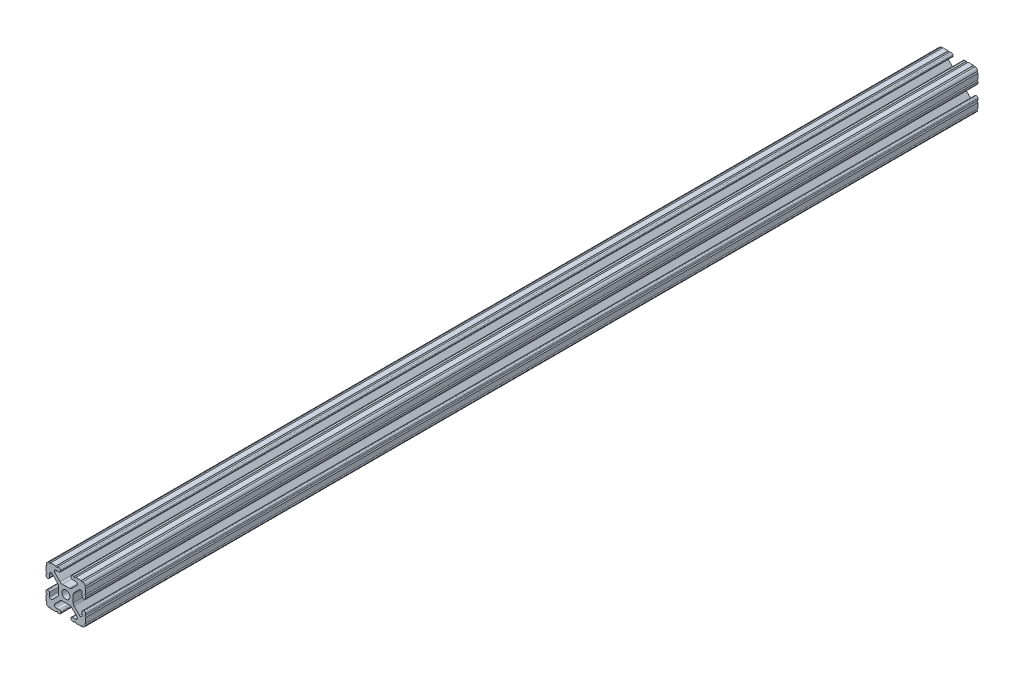
from build123d import *

# Parameters (mm, degrees)
BOSS_EXTRUDE1_DEPTH     = 1524
CUT_EXTRUDE1_DEPTH      = 1525.105829659
CUT_EXTRUDE1_DEPTH_BACK = 1525.105829659
SKETCH5_R               = 0.55245
CUT_EXTRUDE2_DEPTH      = 1525.105829659
CUT_EXTRUDE2_DEPTH_BACK = 1525.105829659
SKETCH8_W               = 50.559993734
SKETCH8_H               = 2489.2


with BuildPart() as part:
    # Sketch4 → Boss-Extrude1 (new, symmetric)
    with BuildSketch(Plane.XY):
        with BuildLine():
            Line((4.190365, -12.7), (10.11729625, -12.7))
            ThreePointArc((10.11729625, -12.7), (11.943543585, -11.943543585), (12.7, -10.11729625))
            Line((12.7, -10.11729625), (12.7, -4.190365))
            ThreePointArc((12.7, -4.190365), (12.42492494, -3.52627506), (11.760835, -3.2512))
            Line((11.760835, -3.2512), (11.429365, -3.2512))
            ThreePointArc((11.429365, -3.2512), (10.76527506, -3.52627506), (10.4902, -4.190365))
            Line((10.4902, -4.190365), (10.4902, -6.348478019))
            ThreePointArc((10.4902, -6.348478019), (9.830707141, -7.335478831), (8.666460301, -7.103895736))
            Line((8.666460301, -7.103895736), (5.299899128, -3.737334563))
            ThreePointArc((5.299899128, -3.737334563), (4.817571085, -3.015479634), (4.6482, -2.16399369))
            Line((4.6482, -2.16399369), (4.6482, 0))
            Line((4.6482, 0), (2.6035, 0))
            ThreePointArc((2.6035, 0), (1.840952505, -1.840952505), (0, -2.6035))
            Line((0, -2.6035), (0, -4.6482))
            Line((0, -4.6482), (2.16399369, -4.6482))
            ThreePointArc((2.16399369, -4.6482), (3.015479634, -4.817571085), (3.737334563, -5.299899128))
            Line((3.737334563, -5.299899128), (7.103895736, -8.666460301))
            ThreePointArc((7.103895736, -8.666460301), (7.335478831, -9.830707141), (6.348478019, -10.4902))
            Line((6.348478019, -10.4902), (4.190365, -10.4902))
            ThreePointArc((4.190365, -10.4902), (3.52627506, -10.76527506), (3.2512, -11.429365))
            Line((3.2512, -11.429365), (3.2512, -11.760835))
            ThreePointArc((3.2512, -11.760835), (3.52627506, -12.42492494), (4.190365, -12.7))
        make_face()
    extrude(amount=BOSS_EXTRUDE1_DEPTH, both=True)

    # Sketch5 → Cut-Extrude1 (cut, two sides: drawn at the far end of the back side and taken through both)
    with BuildSketch(Plane.XY.offset(-CUT_EXTRUDE1_DEPTH_BACK)):
        with Locations((10.356153152, -12.7)):
            Circle(SKETCH5_R)
        with Locations((5.796028019, -12.7)):
            Circle(SKETCH5_R)
        with Locations((12.7, -10.356153152)):
            Circle(SKETCH5_R)
        with Locations((12.7, -5.796028019)):
            Circle(SKETCH5_R)
    extrude(amount=CUT_EXTRUDE1_DEPTH + CUT_EXTRUDE1_DEPTH_BACK, mode=Mode.SUBTRACT)

    # Mirror1: part across plane


with BuildPart() as part_1:
    add(part.part)
    add(part.part.mirror(Plane(origin=(0, 0, 0), x_dir=(0, 0, 1), z_dir=(1, 0, 0))))

    # Mirror2: part across plane


with BuildPart() as part_2:
    add(part_1.part)
    add(part_1.part.mirror(Plane.ZX))

    # Sketch8 → Cut-Extrude2 (cut, two sides: drawn at the far end of the back side and taken through both)
    with BuildSketch(Plane(origin=(0, 0, 0), x_dir=(1, 0, 0), z_dir=(0, 1, 0)).offset(-CUT_EXTRUDE2_DEPTH_BACK)):
        with Locations((0, 292.1)):
            Rectangle(SKETCH8_W, SKETCH8_H)
    extrude(amount=CUT_EXTRUDE2_DEPTH + CUT_EXTRUDE2_DEPTH_BACK, mode=Mode.SUBTRACT)


solid = part_2.part
